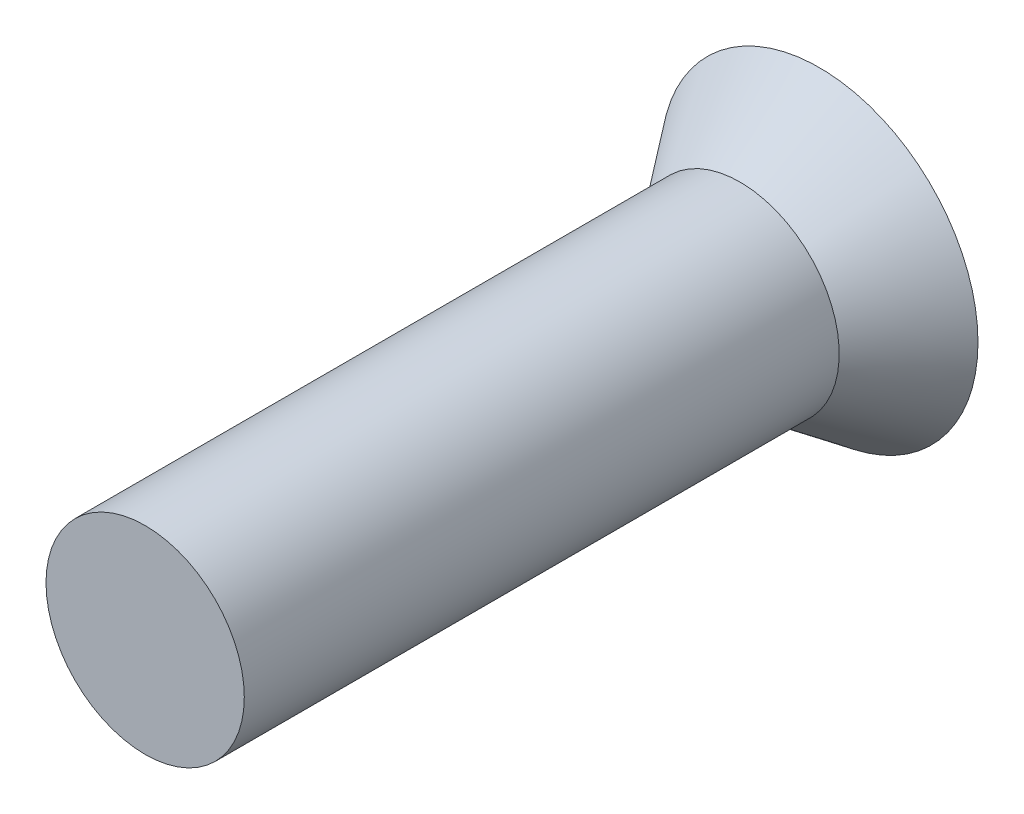
from build123d import *

# Parameters (mm, degrees)
SKETCH1_R           = 4
BOSS_EXTRUDE1_DEPTH = 2
SKETCH2_R           = 2.5
BOSS_EXTRUDE2_DEPTH = 15


with BuildPart() as part:
    # Sketch1 → Boss-Extrude1 (new body)
    with BuildSketch(Plane(origin=(0, 0, 0), x_dir=(0, 1, 0), z_dir=(0, 0, 1))):
        with Locations(Location((0, 0, 0), (0, 0, 270))):
            Circle(SKETCH1_R)
    extrude(amount=BOSS_EXTRUDE1_DEPTH)

    # Sketch2 → Boss-Extrude2 (add)
    with BuildSketch(Plane.XY.offset(2)):
        Circle(SKETCH2_R)
    extrude(amount=BOSS_EXTRUDE2_DEPTH)

    # Sketch3 → Cut-Revolve1 (revolve, cut)
    with BuildSketch(Plane.YZ, mode=Mode.PRIVATE) as cut_revolve1_sk:
        Polygon((-2.5, 2), (-4, 2), (-4, 0), align=None)
    revolve(cut_revolve1_sk.sketch.rotate(Axis((0, 0, 0), (0, 0, 1)), 270), axis=Axis((0, 0, 0), (0, 0, 1)), mode=Mode.SUBTRACT)


solid = part.part
